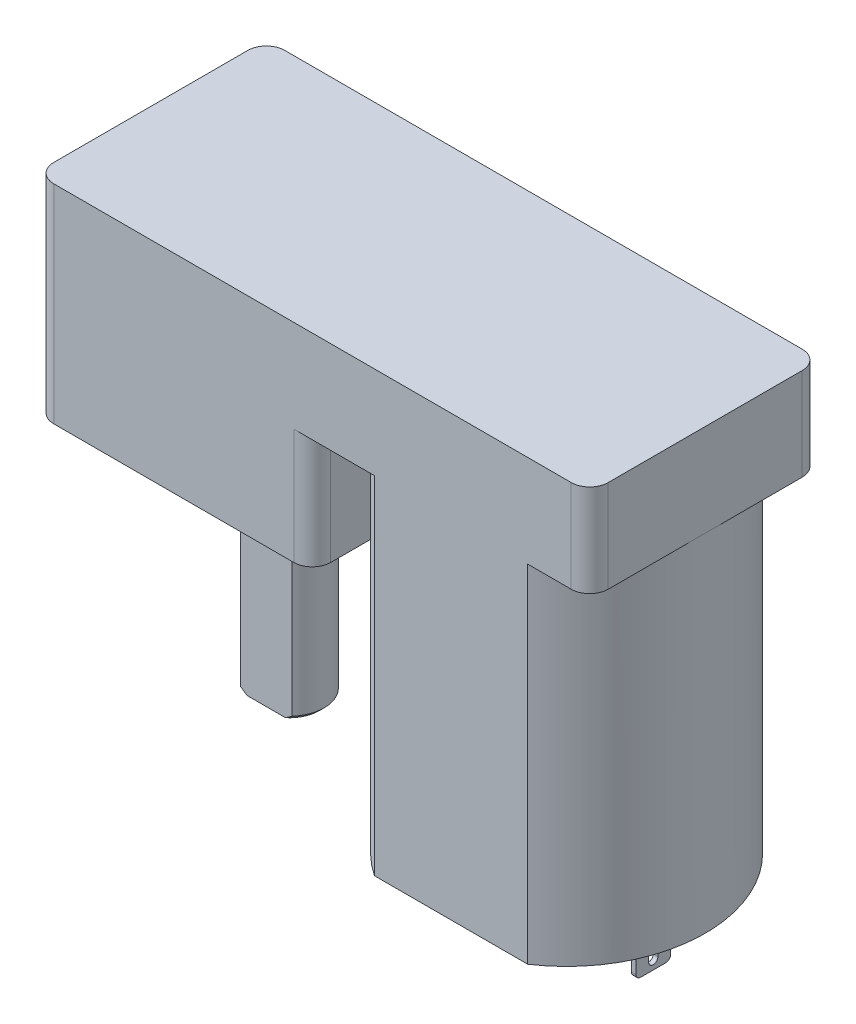
from build123d import *

# Parameters (mm, degrees)
EXTRUDE_1_DEPTH     = 15
SKETCH_2_R          = 2
EXTRUDE_2_DEPTH     = 1
SKETCH_4_W          = 24
SKETCH_4_H          = 10
EXTRUDE_3_DEPTH     = 4
SKETCH_5_W          = 11.99
SKETCH_5_H          = 10
EXTRUDE_6_DEPTH     = 5
EXTRUDE_7_DEPTH     = 10
SKETCH_7_R          = 2
EXTRUDE_8_DEPTH     = 1
SKETCH_8_W          = 0.2
SKETCH_8_H          = 1.5
EXTRUDE_9_DEPTH     = 2.5
CUT_EXTRUDE_1_DEPTH = 9.5
FILLET_1_R          = 0.2
FILLET_2_R          = 0.2
FILLET_3_R          = 0.8
CHAMFER_1_SIZE      = 0.2


with BuildPart() as part:
    # 草图1 → 凸台-拉伸1 (new body)
    with BuildSketch(Plane(origin=(0, 0, 0), x_dir=(1, 0, 0), z_dir=(0, 1, 0))):
        with BuildLine():
            Line((3.31662479, 5), (-3.31662479, 5))
            ThreePointArc((-3.31662479, 5), (-6, 0), (-3.31662479, -5))
            Line((-3.31662479, -5), (3.31662479, -5))
            ThreePointArc((3.31662479, -5), (5.286764074, -2.837274331), (6, 0))
            ThreePointArc((6, 0), (5.286764074, 2.837274331), (3.31662479, 5))
        make_face()
    extrude(amount=EXTRUDE_1_DEPTH)

    # 草图2 → 凸台-拉伸2 (add)
    with BuildSketch(Plane.XZ):
        with Locations(Location((0, 0, 0), (0, 0, 270))):
            Circle(SKETCH_2_R)
    extrude(amount=EXTRUDE_2_DEPTH)

    # 草图4 → 凸台-拉伸3 (add)
    with BuildSketch(Plane(origin=(0, 15, 0), x_dir=(1, 0, 0), z_dir=(0, 1, 0))):
        with Locations((-6, 0)):
            Rectangle(SKETCH_4_W, SKETCH_4_H)
    extrude(amount=EXTRUDE_3_DEPTH)

    # 草图5 → 凸台-拉伸6 (add)
    with BuildSketch(Plane.XZ.offset(-15)):
        with Locations((-12.005, 0)):
            Rectangle(SKETCH_5_W, SKETCH_5_H)
    extrude(amount=EXTRUDE_6_DEPTH)

    # 草图6 → 凸台-拉伸7 (add)
    with BuildSketch(Plane.XZ.offset(-10)):
        with BuildLine():
            ThreePointArc((-13.118033989, 1), (-13.401258538, 0.535233135), (-13.5, 0))
            Line((-13.5, 0), (-10.5, 0))
            ThreePointArc((-10.5, 0), (-10.598741462, 0.535233135), (-10.881966011, 1))
            Line((-10.881966011, 1), (-13.118033989, 1))
        make_face()
        with BuildLine():
            Line((-10.5, 0), (-13.5, 0))
            ThreePointArc((-13.5, 0), (-12, -1.5), (-10.5, 0))
        make_face()
    extrude(amount=EXTRUDE_7_DEPTH)

    # 草图7 → 凸台-拉伸8 (add)
    with BuildSketch(Plane.XZ.offset(-10)):
        with Locations(Location((-12, 0, 0), (0, 0, 270))):
            Circle(SKETCH_7_R)
    extrude(amount=EXTRUDE_8_DEPTH)

    # 草图8 → 凸台-拉伸9 (add)
    with BuildSketch(Plane.XZ):
        with Locations((-3.65, 0)):
            Rectangle(SKETCH_8_W, SKETCH_8_H)
        with Locations((3.65, 0)):
            Rectangle(SKETCH_8_W, SKETCH_8_H)
    extrude(amount=EXTRUDE_9_DEPTH)

    # 草图9 → 切除-拉伸1 (cut)
    with BuildSketch(Plane(origin=(3.75, 0, 0), x_dir=(0, 0, -1), z_dir=(1, 0, 0))):
        with BuildLine():
            Line((-0.2, -2.1), (-0.2, -1.6))
            ThreePointArc((-0.2, -1.6), (0, -1.4), (0.2, -1.6))
            Line((0.2, -1.6), (0.2, -2.1))
            ThreePointArc((0.2, -2.1), (0, -2.3), (-0.2, -2.1))
        make_face()
    extrude(amount=-CUT_EXTRUDE_1_DEPTH, mode=Mode.SUBTRACT)

    # 圆角1
    fillet_1_edges = [part.edges().sort_by_distance(p)[0] for p in [
        (-3.65, -2.5, 0.75),
        (-3.65, -2.5, -0.75),
        (3.65, -2.5, 0.75),
        (3.65, -2.5, -0.75),
    ]]
    fillet(fillet_1_edges, radius=FILLET_1_R)

    # 圆角2
    fillet_2_edges = [part.edges().sort_by_distance(p)[0] for p in [
        (0, -1, 2),
    ]]
    fillet(fillet_2_edges, radius=FILLET_2_R)

    # 圆角3
    fillet_3_edges = [part.edges().sort_by_distance(p)[0] for p in [
        (-18, 14.5, 5),
        (6, 17, 5),
        (6, 17, -5),
        (-18, 14.5, -5),
        (-6.01, 12.5, -5),
        (-6.01, 12.5, 5),
    ]]
    fillet(fillet_3_edges, radius=FILLET_3_R)

    # 倒角1
    chamfer_1_edges = [part.edges().sort_by_distance(p)[0] for p in [
        (-12.535233135, 0, -1.401258538),
    ]]
    chamfer(chamfer_1_edges, length=CHAMFER_1_SIZE)


solid = part.part
